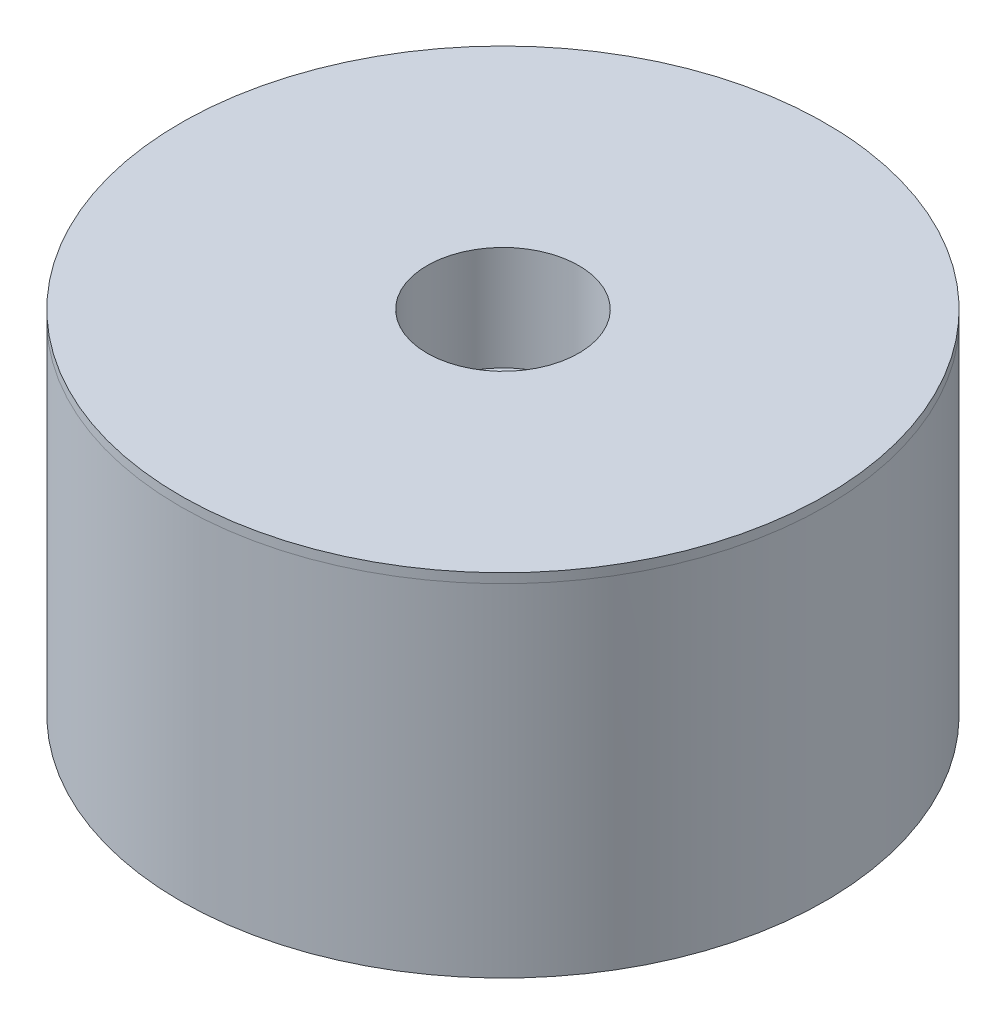
from build123d import *

# Parameters (mm, degrees)
SKETCH1_R           = 17
BOSS_EXTRUDE2_DEPTH = 18
SKETCH3_R           = 2.75
CUT_EXTRUDE2_DEPTH  = 64
SKETCH4_R           = 4
CUT_EXTRUDE3_DEPTH  = 5
SKETCH5_RX          = 17
SKETCH5_RY          = 17
BOSS_EXTRUDE3_DEPTH = 0.5
SKETCH6_R           = 4
CUT_EXTRUDE4_DEPTH  = 0.5


with BuildPart() as part:
    # Sketch1 → Boss-Extrude2 (new body)
    with BuildSketch(Plane(origin=(0, 0, 0), x_dir=(1, 0, 0), z_dir=(0, 1, 0))):
        with Locations(Location((0, 0, 0), (0, 0, 270))):
            Circle(SKETCH1_R)
    extrude(amount=BOSS_EXTRUDE2_DEPTH)

    # Sketch3 → Cut-Extrude2 (cut)
    with BuildSketch(Plane(origin=(0, 18, 0), x_dir=(1, 0, 0), z_dir=(0, 1, 0))):
        with Locations(Location((0, 0, 0), (0, 0, 270))):
            Circle(SKETCH3_R)
    extrude(amount=-CUT_EXTRUDE2_DEPTH, mode=Mode.SUBTRACT)

    # Sketch4 → Cut-Extrude3 (cut)
    with BuildSketch(Plane(origin=(0, 18, 0), x_dir=(1, 0, 0), z_dir=(0, 1, 0))):
        with Locations(Location((0, 0, 0), (0, 0, 270))):
            Circle(SKETCH4_R)
    extrude(amount=-CUT_EXTRUDE3_DEPTH, mode=Mode.SUBTRACT)

    # Sketch5 → Boss-Extrude3 (add)
    with BuildSketch(Plane(origin=(0, 18, 0), x_dir=(1, 0, 0), z_dir=(0, 1, 0))):
        with Locations(Location((0, 0), (0, 0, -2.815048359))):
            Ellipse(SKETCH5_RX, SKETCH5_RY)
    extrude(amount=BOSS_EXTRUDE3_DEPTH)

    # Sketch6 → Cut-Extrude4 (cut)
    with BuildSketch(Plane(origin=(0, 18.5, 0), x_dir=(1, 0, 0), z_dir=(0, 1, 0))):
        with Locations(Location((0, 0, 0), (0, 0, 270))):
            Circle(SKETCH6_R)
    extrude(amount=-CUT_EXTRUDE4_DEPTH, mode=Mode.SUBTRACT)


solid = part.part
